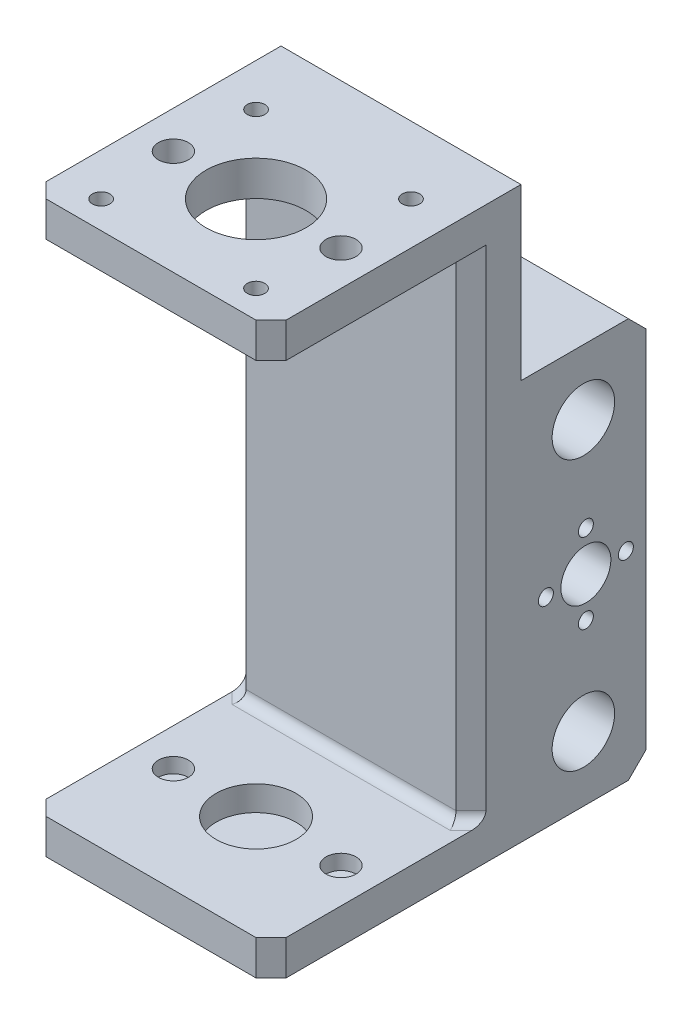
from build123d import *

# Parameters (mm, degrees)
SKETCH_1_W          = 48
SKETCH_1_H          = 100
EXTRUDE_1_DEPTH     = 10
SKETCH_4_W          = 48
SKETCH_4_H          = 50
SKETCH_4_R          = 10
SKETCH_4_R_2        = 3
SKETCH_4_R_3        = 1.75
EXTRUDE_3_DEPTH     = 7
EXTRUDE_START       = 7
SKETCH_6_W          = 48
SKETCH_6_H          = 50
SKETCH_6_R          = 8
SKETCH_6_R_2        = 3
EXTRUDE_4_DEPTH     = 7
SKETCH_3_W          = 48
SKETCH_3_H          = 80
EXTRUDE_2_DEPTH     = 25
CHAMFER_1_SIZE      = 3
FILLET_1_R          = 2
SKETCH_7_R          = 3
EXTRUDE_5_DEPTH     = 4
EXTRUDE_5_2_DEPTH   = 4
SKETCH_8_R          = 5
SKETCH_8_R_2        = 1.5
SKETCH_8_R_3        = 6.25
CUT_EXTRUDE_3_DEPTH = 90.738509014
SKETCH_9_R          = 3
CUT_EXTRUDE_4_DEPTH = 3
CHAMFER_5_SIZE      = 3.5
SKETCH_10_R         = 8
EXTRUDE_6_DEPTH     = 2


with BuildPart() as part:
    # 草圖1 → 填料-伸長1 (new body)
    with BuildSketch(Plane.XY):
        Rectangle(SKETCH_1_W, SKETCH_1_H)
    extrude(amount=EXTRUDE_1_DEPTH)

    # 草圖4 → 填料-伸長3 (add)
    with BuildSketch(Plane(origin=(0, 50, 0), x_dir=(1, 0, 0), z_dir=(0, 1, 0))):
        with Locations((0, -25)):
            Rectangle(SKETCH_4_W, SKETCH_4_H)
        with Locations(Location((0, -29, 0), (0, 0, 270))):
            Circle(SKETCH_4_R, mode=Mode.SUBTRACT)
        with Locations(Location((17, -29, 0), (0, 0, 270))):
            Circle(SKETCH_4_R_2, mode=Mode.SUBTRACT)
        with Locations(Location((-16.534045139, -29, 0), (0, 0, 270))):
            Circle(SKETCH_4_R_2, mode=Mode.SUBTRACT)
        with Locations(Location((15.5, -44.5, 0), (0, 0, 270))):
            Circle(SKETCH_4_R_3, mode=Mode.SUBTRACT)
        with Locations(Location((15.5, -13.5, 0), (0, 0, 270))):
            Circle(SKETCH_4_R_3, mode=Mode.SUBTRACT)
        with Locations(Location((-15.5, -13.5, 0), (0, 0, 270))):
            Circle(SKETCH_4_R_3, mode=Mode.SUBTRACT)
        with Locations(Location((-15.5, -44.5, 0), (0, 0, 270))):
            Circle(SKETCH_4_R_3, mode=Mode.SUBTRACT)
    extrude(amount=EXTRUDE_3_DEPTH)

    # 草圖6 → 填料-伸長4 (add)
    with BuildSketch(Plane.XZ.offset(50).offset(EXTRUDE_START)):
        with Locations((0, 25)):
            Rectangle(SKETCH_6_W, SKETCH_6_H)
        with Locations(Location((0, 29, 0), (0, 0, 270))):
            Circle(SKETCH_6_R, mode=Mode.SUBTRACT)
        with Locations(Location((-16.534045139, 29, 0), (0, 0, 90))):
            Circle(SKETCH_6_R_2, mode=Mode.SUBTRACT)
        with Locations(Location((17, 29, 0), (0, 0, 90))):
            Circle(SKETCH_6_R_2, mode=Mode.SUBTRACT)
    extrude(amount=-EXTRUDE_4_DEPTH)

    # 草圖3 → 填料-伸長2 (add)
    with BuildSketch(Plane(origin=(0, 0, 0), x_dir=(-1, 0, 0), z_dir=(0, 0, -1))):
        with Locations((0, -17)):
            Rectangle(SKETCH_3_W, SKETCH_3_H)
    extrude(amount=EXTRUDE_2_DEPTH)

    # 導角1
    chamfer_1_edges = [part.edges().sort_by_distance(p)[0] for p in [
        (24, 0, 10),
        (24, 53.5, 50),
        (-24, 53.5, 50),
        (-24, 0, 10),
        (-24, -53.5, 50),
        (24, -53.5, 50),
    ]]
    chamfer(chamfer_1_edges, length=CHAMFER_1_SIZE)

    # 圓角1
    fillet_1_edges = [part.edges().sort_by_distance(p)[0] for p in [
        (0, -50, 10),
        (22.5, -50, 8.5),
        (-22.5, -50, 8.5),
    ]]
    fillet(fillet_1_edges, radius=FILLET_1_R)

    # 草圖8 → 除料-伸長3 (cut, through all)
    with BuildSketch(Plane(origin=(24, 0, 0), x_dir=(0, 0, -1), z_dir=(1, 0, 0))):
        with Locations((13, -17)):
            Circle(SKETCH_8_R)
        with Locations((21, -17)):
            Circle(SKETCH_8_R_2)
        with Locations((13, -25)):
            Circle(SKETCH_8_R_2)
        with Locations((5, -17)):
            Circle(SKETCH_8_R_2)
        with Locations((13, -9)):
            Circle(SKETCH_8_R_2)
        with Locations((12.5, 10)):
            Circle(SKETCH_8_R_3)
        with Locations((12.5, -43.995369973)):
            Circle(SKETCH_8_R_3)
    extrude(amount=-CUT_EXTRUDE_3_DEPTH, mode=Mode.SUBTRACT)

    # 草圖9 → 除料-伸長4 (cut)
    with BuildSketch(Plane.XZ.offset(-50)):
        with Locations(Location((-15.5, 44.5, 0), (0, 0, 270))):
            Circle(SKETCH_9_R)
        with Locations(Location((-15.5, 13.5, 0), (0, 0, 270))):
            Circle(SKETCH_9_R)
        with Locations(Location((15.5, 13.5, 0), (0, 0, 270))):
            Circle(SKETCH_9_R)
        with Locations(Location((15.5, 44.5, 0), (0, 0, 270))):
            Circle(SKETCH_9_R)
    extrude(amount=-CUT_EXTRUDE_4_DEPTH, mode=Mode.SUBTRACT)

    # 導角5
    chamfer_5_edges = [part.edges().sort_by_distance(p)[0] for p in [
        (0, -57, -25),
        (0, 23, -25),
    ]]
    chamfer(chamfer_5_edges, length=CHAMFER_5_SIZE)


with BuildPart() as body_2:
    # 草圖7 → 填料-伸長5 (new body)
    with BuildSketch(Plane.XZ.offset(57)):
        with Locations(Location((17, 29, 0), (0, 0, 270))):
            Circle(SKETCH_7_R)
    extrude(amount=-EXTRUDE_5_DEPTH)


with BuildPart() as body_3:
    # 草圖7 → Extrude 5 2 (new body)
    with BuildSketch(Plane.XZ.offset(57)):
        with Locations(Location((-16.534045139, 29, 0), (0, 0, 270))):
            Circle(SKETCH_7_R)
    extrude(amount=-EXTRUDE_5_2_DEPTH)


with BuildPart() as body_4:
    # 草圖10 → 填料-伸長6 (new body)
    with BuildSketch(Plane.XZ.offset(57)):
        with Locations(Location((0, 29, 0), (0, 0, 270))):
            Circle(SKETCH_10_R)
    extrude(amount=-EXTRUDE_6_DEPTH)


solid = Compound([part.part, body_2.part, body_3.part, body_4.part])
